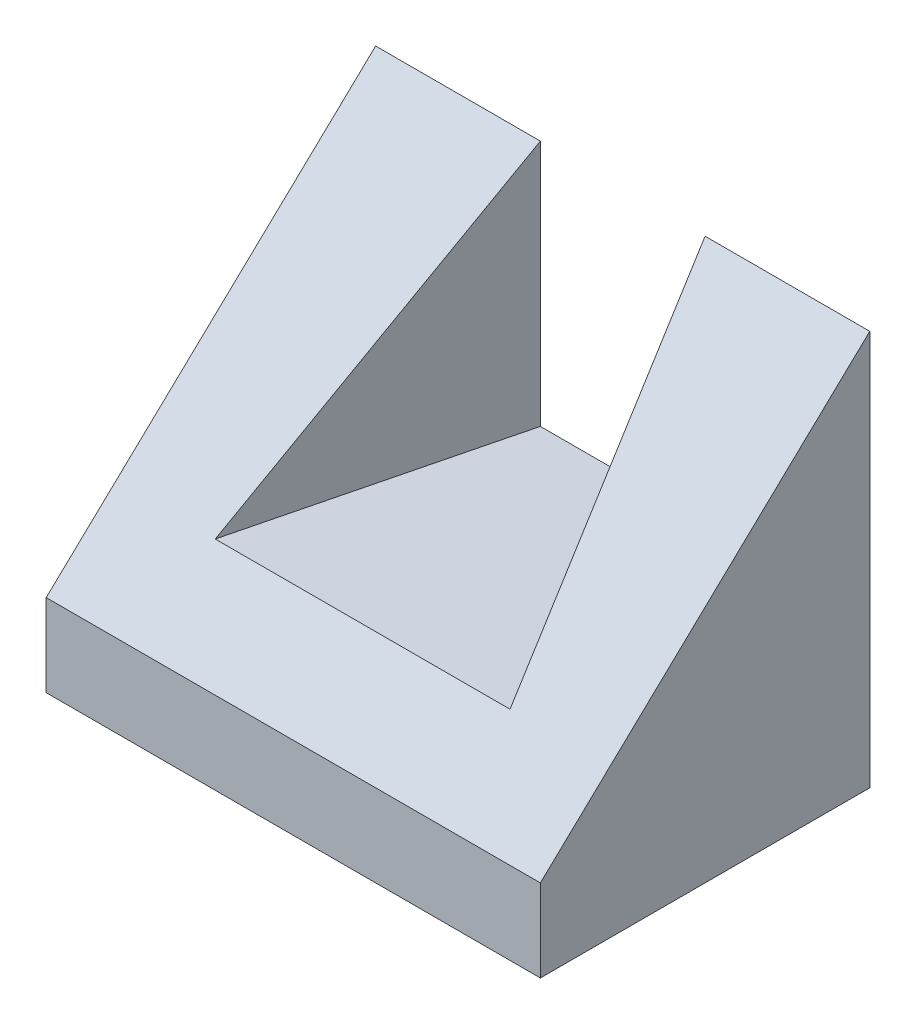
from build123d import *

# Parameters (mm, degrees)
SKETCH_1_W          = 30
SKETCH_1_H          = 24
EXTRUDE_1_DEPTH     = 20
CUT_EXTRUDE_1_DEPTH = 15
CUT_EXTRUDE_2_DEPTH = 39


with BuildPart() as part:
    # 草圖1 → 填料-伸長1 (new body)
    with BuildSketch(Plane.XY):
        Rectangle(SKETCH_1_W, SKETCH_1_H)
    extrude(amount=-EXTRUDE_1_DEPTH)

    # 草圖2 → 除料-伸長1 (cut)
    with BuildSketch(Plane(origin=(0, 12, 0), x_dir=(1, 0, 0), z_dir=(0, 1, 0))):
        Polygon((0, 0), (0, 20), (-5, 20), (-10, 0), align=None)
        Polygon((10, 0), (5, 20), (0, 20), (0, 0), align=None)
    extrude(amount=-CUT_EXTRUDE_1_DEPTH, mode=Mode.SUBTRACT)

    # 草圖3 → 除料-伸長2 (cut, through all)
    with BuildSketch(Plane(origin=(15, 0, 0), x_dir=(0, 0, -1), z_dir=(1, 0, 0))):
        Polygon((0, -7), (20, 12), (0, 12), align=None)
    extrude(amount=-CUT_EXTRUDE_2_DEPTH, mode=Mode.SUBTRACT)


solid = part.part
